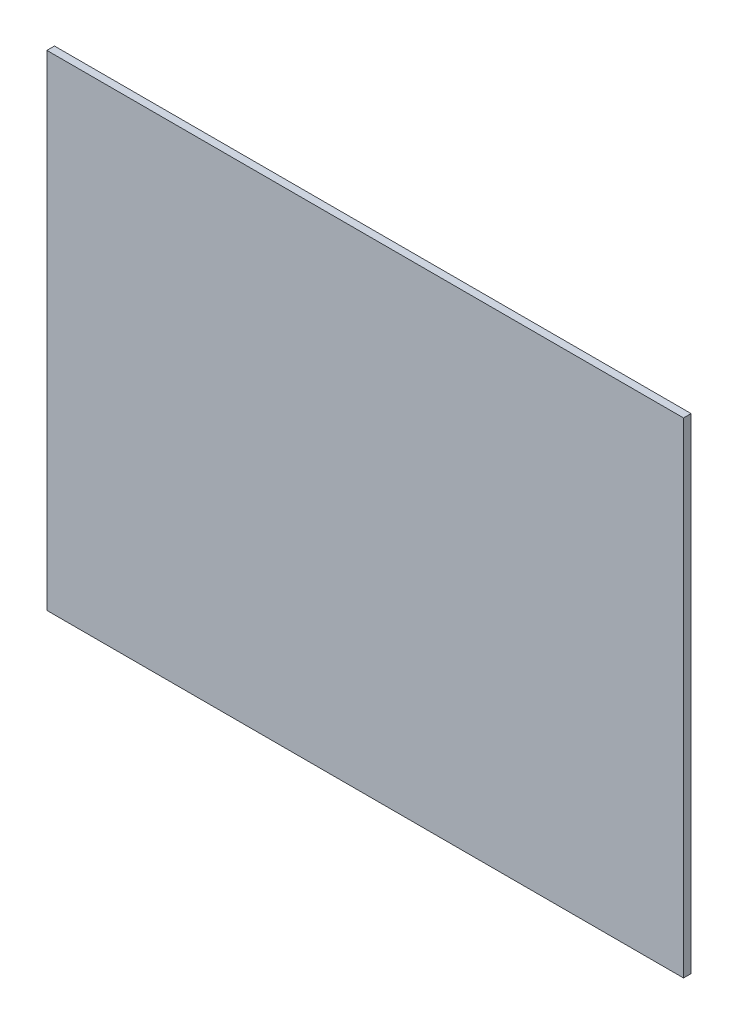
from build123d import *

# Parameters (mm, degrees)
ESQUISSE2_W        = 420
ESQUISSE2_H        = 320
BOSS_EXTRU_1_DEPTH = 5


with BuildPart() as part:
    # Esquisse2 → Boss.-Extru.1 (new body)
    with BuildSketch(Plane.XY):
        Rectangle(ESQUISSE2_W, ESQUISSE2_H)
    extrude(amount=BOSS_EXTRU_1_DEPTH)


solid = part.part
